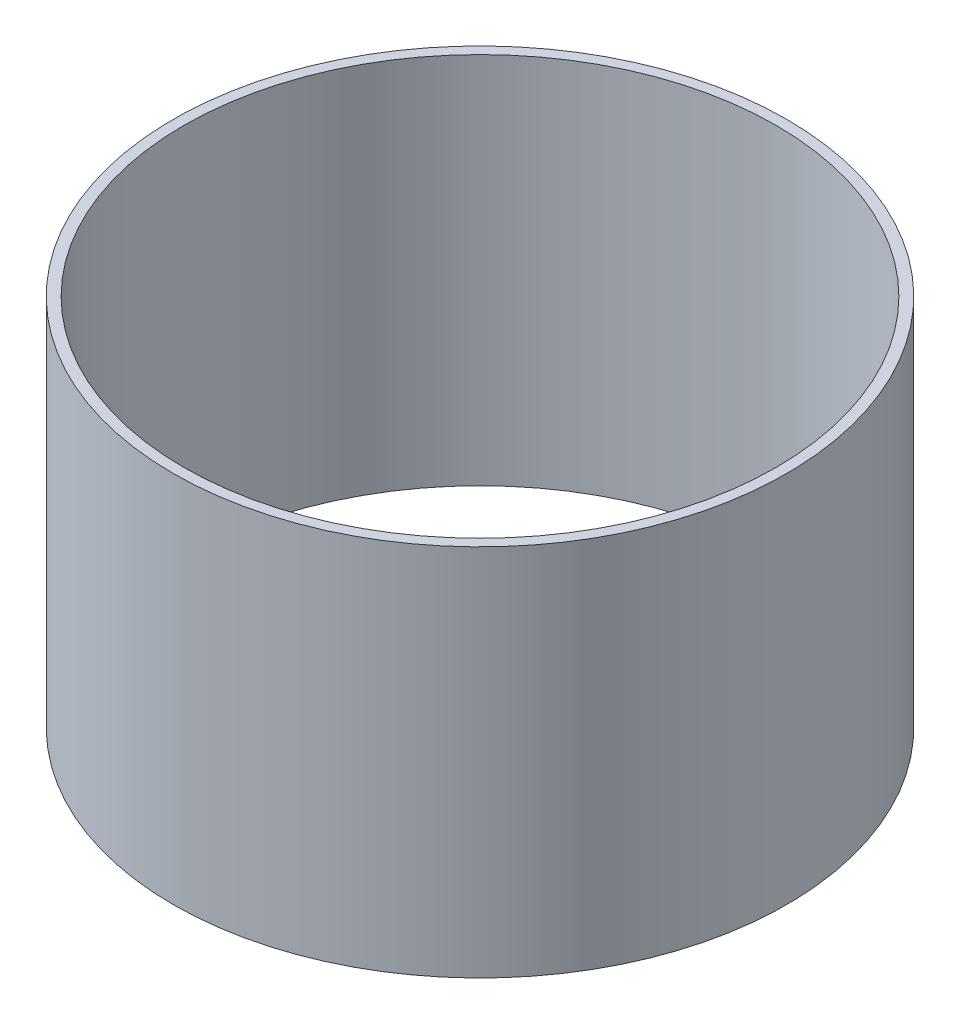
from build123d import *

# Parameters (mm, degrees)
SKETCH1_R           = 109.5375
SKETCH1_R_2         = 105.7783
BOSS_EXTRUDE1_DEPTH = 66.675


with BuildPart() as part:
    # Sketch1 → Boss-Extrude1 (new, symmetric)
    with BuildSketch(Plane(origin=(0, 0, 0), x_dir=(1, 0, 0), z_dir=(0, 1, 0))):
        with Locations(Location((0, 0, 0), (0, 0, 270))):
            Circle(SKETCH1_R)
        with Locations(Location((0, 0, 0), (0, 0, 270))):
            Circle(SKETCH1_R_2, mode=Mode.SUBTRACT)
    extrude(amount=BOSS_EXTRUDE1_DEPTH, both=True)


solid = part.part
